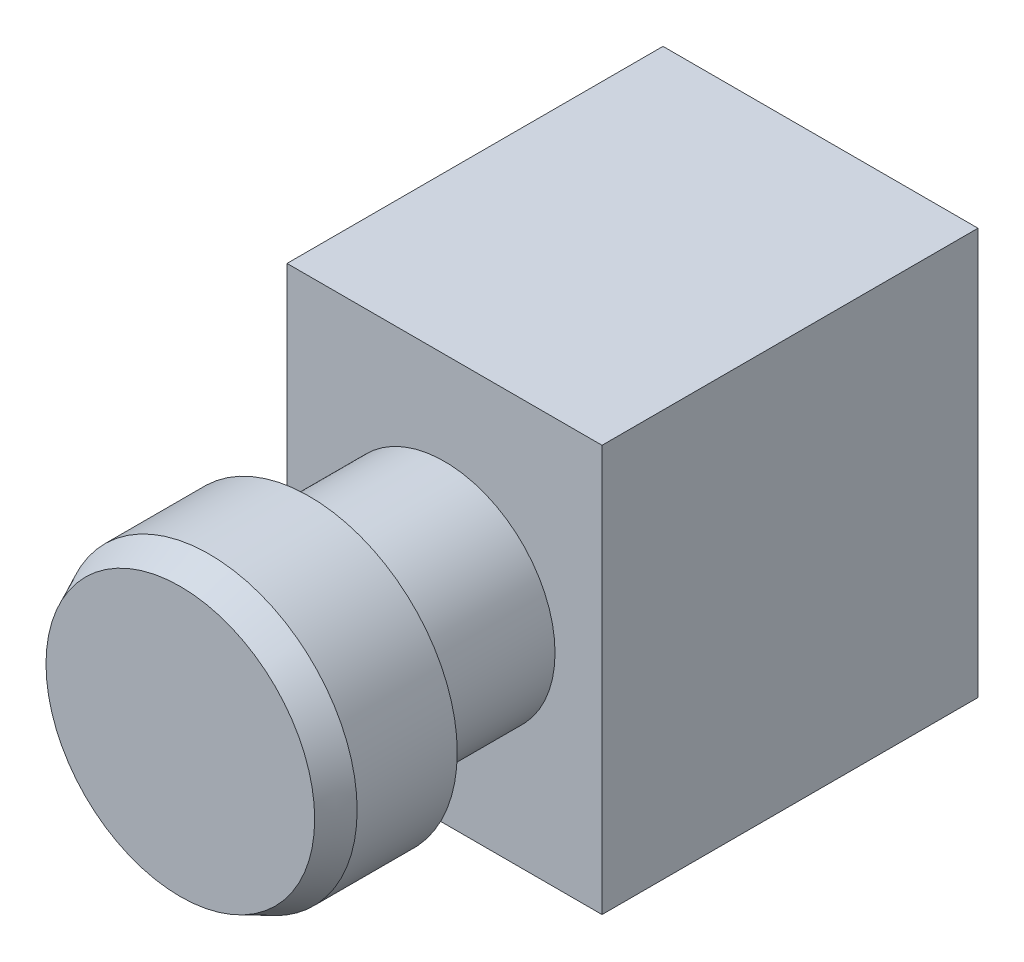
from build123d import *

# Parameters (mm, degrees)
SKETCH1_R           = 14.55
BOSS_EXTRUDE1_DEPTH = 9.85
SKETCH3_R           = 14.55
BOSS_EXTRUDE3_DEPTH = 2.85
BOSS_EXTRUDE3_TAPER = 25
SKETCH4_R           = 10.875
BOSS_EXTRUDE4_DEPTH = 13.3
SKETCH2_W           = 31
SKETCH2_H           = 40
BOSS_EXTRUDE2_DEPTH = 37


with BuildPart() as part:
    # Sketch1 → Boss-Extrude1 (new body)
    with BuildSketch(Plane.XY):
        Circle(SKETCH1_R)
    extrude(amount=BOSS_EXTRUDE1_DEPTH)

    # Sketch3 → Boss-Extrude3 (add)
    with BuildSketch(Plane.XY.offset(9.85)):
        Circle(SKETCH3_R)
    extrude(amount=BOSS_EXTRUDE3_DEPTH, taper=BOSS_EXTRUDE3_TAPER)

    # Sketch4 → Boss-Extrude4 (add)
    with BuildSketch(Plane.XY):
        Circle(SKETCH4_R)
    extrude(amount=-BOSS_EXTRUDE4_DEPTH)

    # Sketch2 → Boss-Extrude2 (add)
    with BuildSketch(Plane.XY.offset(-13.3)):
        Rectangle(SKETCH2_W, SKETCH2_H)
    extrude(amount=-BOSS_EXTRUDE2_DEPTH)


solid = part.part
